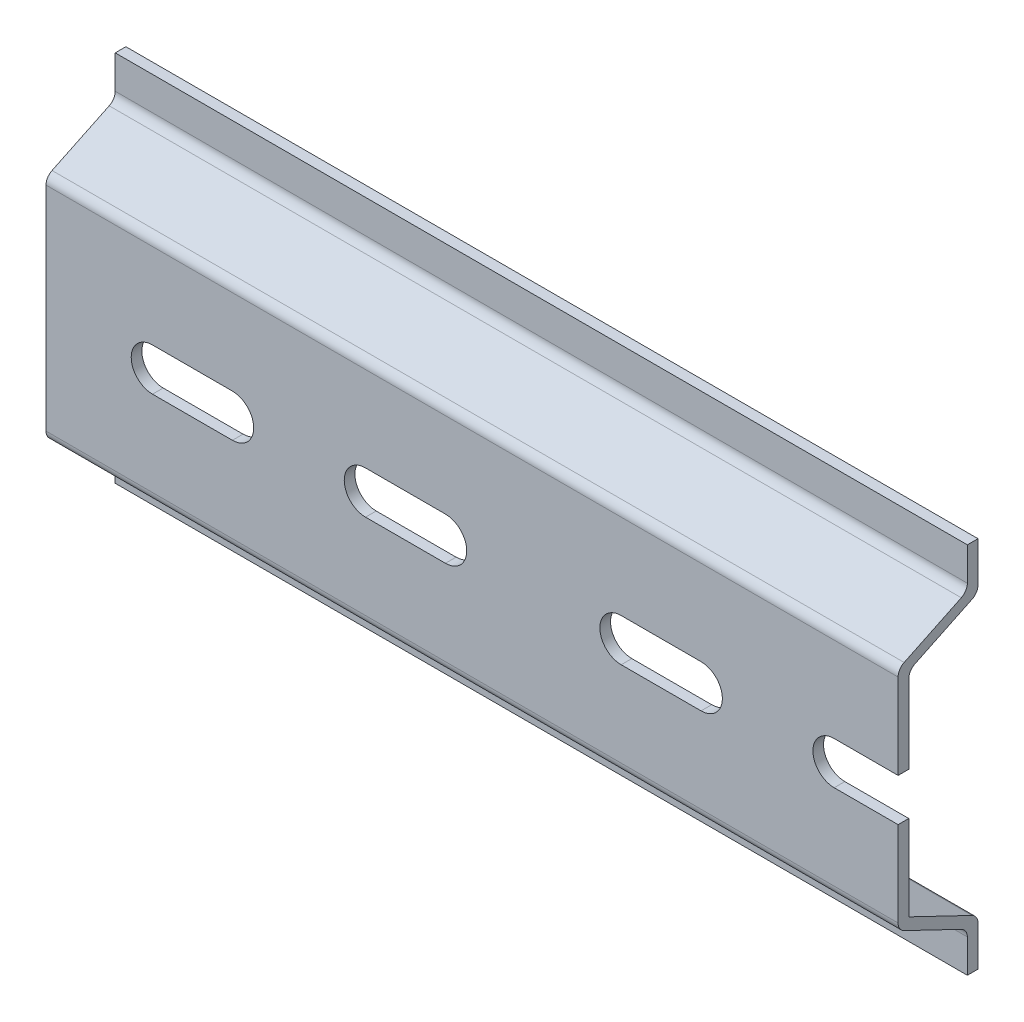
from build123d import *

# Parameters (mm, degrees)
EXTRUDE_1_DEPTH     = 80
FILLET_1_R          = 1
CUT_EXTRUDE_1_DEPTH = 10


with BuildPart() as part:
    # 草图1 → 凸台-拉伸1 (new body)
    with BuildSketch(Plane(origin=(0, 0, 0), x_dir=(0, 0, -1), z_dir=(1, 0, 0))):
        Polygon((0, -10), (0, 10), (6.5, 13.120839269), (6.5, 17.5), (5.5, 17.5), (5.5, 13.75), (-1, 10.629160731), (-1, -10.629160731), (5.5, -13.75), (5.5, -17.5), (6.5, -17.5), (6.5, -13.120839269), align=None)
    extrude(amount=EXTRUDE_1_DEPTH)

    # 圆角1
    fillet_1_edges = [part.edges().sort_by_distance(p)[0] for p in [
        (40, 10, 0),
        (40, -13.120839269, -6.5),
        (40, -13.75, -5.5),
        (40, -10.629160731, 1),
        (40, 10.629160731, 1),
        (40, 13.75, -5.5),
        (40, 13.120839269, -6.5),
    ]]
    fillet(fillet_1_edges, radius=FILLET_1_R)

    # 草图2 → 切除-拉伸1 (cut)
    with BuildSketch(Plane(origin=(0, 0, 0), x_dir=(-1, 0, 0), z_dir=(0, 0, -1))):
        with BuildLine():
            Line((-10, -2), (-17.5, -2))
            ThreePointArc((-17.5, -2), (-19.5, 0), (-17.5, 2))
            Line((-17.5, 2), (-10, 2))
            ThreePointArc((-10, 2), (-8, 0), (-10, -2))
        make_face()
        with BuildLine():
            Line((-30, -2), (-37.5, -2))
            ThreePointArc((-37.5, -2), (-39.5, 0), (-37.5, 2))
            Line((-37.5, 2), (-30, 2))
            ThreePointArc((-30, 2), (-28, 0), (-30, -2))
        make_face()
        with BuildLine():
            Line((-54, -2), (-61.5, -2))
            ThreePointArc((-61.5, -2), (-63.5, 0), (-61.5, 2))
            Line((-61.5, 2), (-54, 2))
            ThreePointArc((-54, 2), (-52, 0), (-54, -2))
        make_face()
        with BuildLine():
            Line((-74, -2), (-81.5, -2))
            ThreePointArc((-81.5, -2), (-83.5, 0), (-81.5, 2))
            Line((-81.5, 2), (-74, 2))
            ThreePointArc((-74, 2), (-72, 0), (-74, -2))
        make_face()
        with BuildLine():
            Line((-98, -2), (-105.5, -2))
            ThreePointArc((-105.5, -2), (-107.5, 0), (-105.5, 2))
            Line((-105.5, 2), (-98, 2))
            ThreePointArc((-98, 2), (-96, 0), (-98, -2))
        make_face()
        with BuildLine():
            Line((-118, -2), (-125.5, -2))
            ThreePointArc((-125.5, -2), (-127.5, 0), (-125.5, 2))
            Line((-125.5, 2), (-118, 2))
            ThreePointArc((-118, 2), (-116, 0), (-118, -2))
        make_face()
        with BuildLine():
            Line((-142, -2), (-149.5, -2))
            ThreePointArc((-149.5, -2), (-151.5, 0), (-149.5, 2))
            Line((-149.5, 2), (-142, 2))
            ThreePointArc((-142, 2), (-140, 0), (-142, -2))
        make_face()
        with BuildLine():
            Line((-162, -2), (-169.5, -2))
            ThreePointArc((-169.5, -2), (-171.5, 0), (-169.5, 2))
            Line((-169.5, 2), (-162, 2))
            ThreePointArc((-162, 2), (-160, 0), (-162, -2))
        make_face()
        with BuildLine():
            Line((-186, -2), (-193.5, -2))
            ThreePointArc((-193.5, -2), (-195.5, 0), (-193.5, 2))
            Line((-193.5, 2), (-186, 2))
            ThreePointArc((-186, 2), (-184, 0), (-186, -2))
        make_face()
        with BuildLine():
            Line((-206, -2), (-213.5, -2))
            ThreePointArc((-213.5, -2), (-215.5, 0), (-213.5, 2))
            Line((-213.5, 2), (-206, 2))
            ThreePointArc((-206, 2), (-204, 0), (-206, -2))
        make_face()
        with BuildLine():
            Line((-230, -2), (-237.5, -2))
            ThreePointArc((-237.5, -2), (-239.5, 0), (-237.5, 2))
            Line((-237.5, 2), (-230, 2))
            ThreePointArc((-230, 2), (-228, 0), (-230, -2))
        make_face()
        with BuildLine():
            Line((-250, -2), (-257.5, -2))
            ThreePointArc((-257.5, -2), (-259.5, 0), (-257.5, 2))
            Line((-257.5, 2), (-250, 2))
            ThreePointArc((-250, 2), (-248, 0), (-250, -2))
        make_face()
        with BuildLine():
            Line((-274, -2), (-281.5, -2))
            ThreePointArc((-281.5, -2), (-283.5, 0), (-281.5, 2))
            Line((-281.5, 2), (-274, 2))
            ThreePointArc((-274, 2), (-272, 0), (-274, -2))
        make_face()
        with BuildLine():
            Line((-294, -2), (-301.5, -2))
            ThreePointArc((-301.5, -2), (-303.5, 0), (-301.5, 2))
            Line((-301.5, 2), (-294, 2))
            ThreePointArc((-294, 2), (-292, 0), (-294, -2))
        make_face()
        with BuildLine():
            Line((-318, -2), (-325.5, -2))
            ThreePointArc((-325.5, -2), (-327.5, 0), (-325.5, 2))
            Line((-325.5, 2), (-318, 2))
            ThreePointArc((-318, 2), (-316, 0), (-318, -2))
        make_face()
        with BuildLine():
            Line((-338, -2), (-345.5, -2))
            ThreePointArc((-345.5, -2), (-347.5, 0), (-345.5, 2))
            Line((-345.5, 2), (-338, 2))
            ThreePointArc((-338, 2), (-336, 0), (-338, -2))
        make_face()
        with BuildLine():
            Line((-362, -2), (-369.5, -2))
            ThreePointArc((-369.5, -2), (-371.5, 0), (-369.5, 2))
            Line((-369.5, 2), (-362, 2))
            ThreePointArc((-362, 2), (-360, 0), (-362, -2))
        make_face()
        with BuildLine():
            Line((-382, -2), (-389.5, -2))
            ThreePointArc((-389.5, -2), (-391.5, 0), (-389.5, 2))
            Line((-389.5, 2), (-382, 2))
            ThreePointArc((-382, 2), (-380, 0), (-382, -2))
        make_face()
    extrude(amount=-CUT_EXTRUDE_1_DEPTH, mode=Mode.SUBTRACT)


solid = part.part
